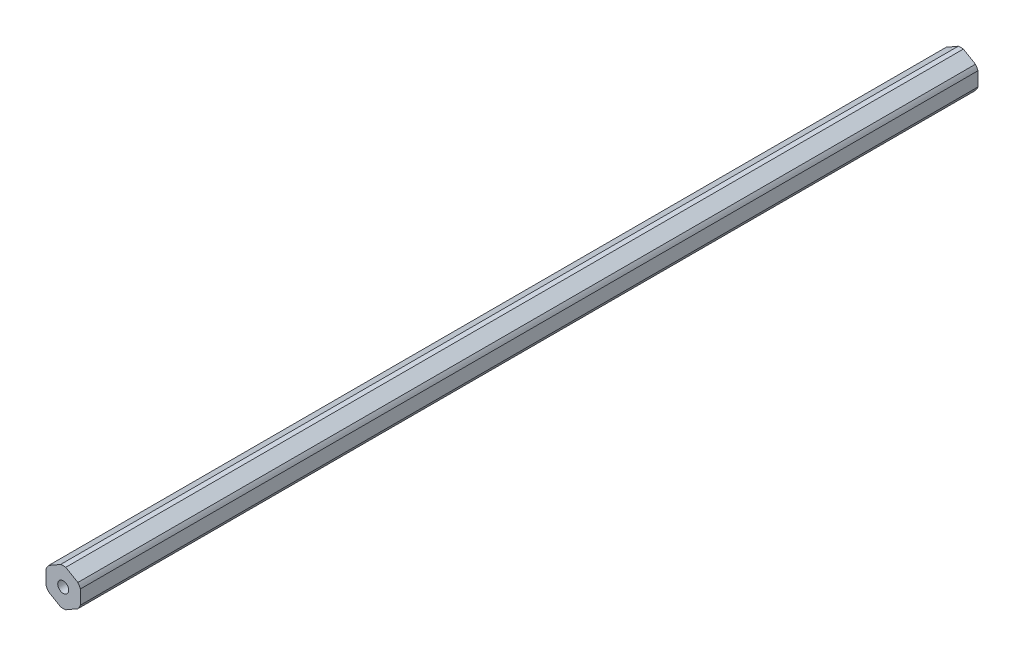
from build123d import *

# Parameters (mm, degrees)
BOSS_EXTRUDE1_DEPTH                  = 165.66388
F_10_32_TAPPED_HOLE1_D               = 4.0386
F_10_32_TAPPED_HOLE1_DEPTH           = 16.34744
F_10_32_TAPPED_HOLE1_TIP             = 1.213317848
F_10_32_TAPPED_HOLE1_ON_FACE_2_D     = 4.0386
F_10_32_TAPPED_HOLE1_ON_FACE_2_DEPTH = 16.34744
F_10_32_TAPPED_HOLE1_ON_FACE_2_TIP   = 1.213317848


with BuildPart() as part:
    # Sketch1 → Boss-Extrude1 (new, symmetric)
    with BuildSketch(Plane.XY):
        with BuildLine():
            ThreePointArc((0.93173274, 6.79441227), (0, 6.858), (-0.93173274, 6.79441227))
            Line((-0.93173274, 6.79441227), (-5.41826726, 4.204110358))
            ThreePointArc((-5.41826726, 4.204110358), (-5.939202219, 3.429), (-6.35, 2.590301913))
            Line((-6.35, 2.590301913), (-6.35, -2.590301913))
            ThreePointArc((-6.35, -2.590301913), (-5.939202219, -3.429), (-5.41826726, -4.204110358))
            Line((-5.41826726, -4.204110358), (-0.93173274, -6.79441227))
            ThreePointArc((-0.93173274, -6.79441227), (0, -6.858), (0.93173274, -6.79441227))
            Line((0.93173274, -6.79441227), (5.41826726, -4.204110358))
            ThreePointArc((5.41826726, -4.204110358), (5.939202219, -3.429), (6.35, -2.590301913))
            Line((6.35, -2.590301913), (6.35, 2.590301913))
            ThreePointArc((6.35, 2.590301913), (5.939202219, 3.429), (5.41826726, 4.204110358))
            Line((5.41826726, 4.204110358), (0.93173274, 6.79441227))
        make_face()
    extrude(amount=BOSS_EXTRUDE1_DEPTH, both=True)

    # #10-32 Tapped Hole1
    with Locations(Plane.XY.offset(165.66388)):
        with Locations((0, 0)):
            Hole(F_10_32_TAPPED_HOLE1_D / 2, depth=F_10_32_TAPPED_HOLE1_DEPTH)
            with Locations((0, 0, -(F_10_32_TAPPED_HOLE1_DEPTH + F_10_32_TAPPED_HOLE1_TIP / 2))):  # 118° drill point
                Cone(0, F_10_32_TAPPED_HOLE1_D / 2, F_10_32_TAPPED_HOLE1_TIP, mode=Mode.SUBTRACT)

    # #10-32 Tapped Hole1 on face 2
    with Locations(Plane(origin=(0, 0, -165.66388), x_dir=(-1, 0, 0), z_dir=(0, 0, -1))):
        with Locations((0, 0)):
            Hole(F_10_32_TAPPED_HOLE1_ON_FACE_2_D / 2, depth=F_10_32_TAPPED_HOLE1_ON_FACE_2_DEPTH)
            with Locations((0, 0, -(F_10_32_TAPPED_HOLE1_ON_FACE_2_DEPTH + F_10_32_TAPPED_HOLE1_ON_FACE_2_TIP / 2))):  # 118° drill point
                Cone(0, F_10_32_TAPPED_HOLE1_ON_FACE_2_D / 2, F_10_32_TAPPED_HOLE1_ON_FACE_2_TIP, mode=Mode.SUBTRACT)


solid = part.part
